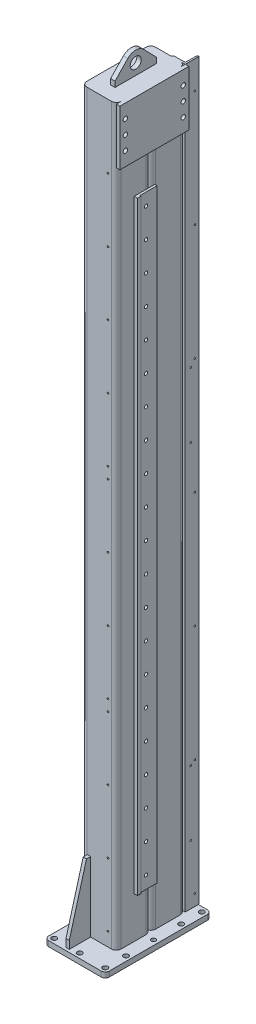
from build123d import *

# Parameters (mm, degrees)
EXTRUDE_1_DEPTH           = 2643
EXTRUDE_2_DEPTH           = 2643
CUT_EXTRUDE_1_DEPTH       = 2648.712267222
CUT_EXTRUDE_1_DEPTH_BACK  = 2648.712267222
EXTRUDE_3_DEPTH           = 19
EXTRUDE_4_DEPTH           = 12
EXTRUDE_5_DEPTH           = 2662
EXTRUDE_6_DEPTH           = 2190
EXTRUDE_7_DEPTH           = 19
SKETCH_14_W               = 249.98
SKETCH_14_H               = 200
EXTRUDE_8_DEPTH           = 13
EXTRUDE_9_DEPTH           = 8
EXTRUDE_9_DEPTH_BACK      = 8
SKETCH_17_R               = 9
CUT_EXTRUDE_3_DEPTH       = 19
SKETCH_19_R               = 8
CUT_EXTRUDE_5_DEPTH       = 19
SKETCH_69_R               = 8
CUT_EXTRUDE_54_DEPTH      = 75.5
SKETCH_71_R               = 8
CUT_EXTRUDE_56_DEPTH      = 75.5
SKETCH_73_R               = 6
CUT_EXTRUDE_58_DEPTH      = 70.5
SKETCH_75_R               = 3
CUT_EXTRUDE_60_DEPTH      = 105
SKETCH_77_R               = 3
CUT_EXTRUDE_62_DEPTH      = 62.5
SKETCH_79_R               = 3
CUT_EXTRUDE_64_DEPTH      = 62.5
CUT_EXTRUDE_65_DEPTH      = 2771.06245417
CUT_EXTRUDE_65_DEPTH_BACK = 2771.06245417
SKETCH_80_R               = 20


with BuildPart() as part:
    # ｽｹｯﾁ2 → ﾎﾞｽ - 押し出し1 (new body)
    with BuildSketch(Plane(origin=(0, 19, 0), x_dir=(1, 0, 0), z_dir=(0, 1, 0))):
        with BuildLine():
            Line((-44.5, -105), (44.5, -105))
            ThreePointArc((44.5, -105), (57.227922061, -99.727922061), (62.5, -87))
            Line((62.5, -87), (62.5, 2))
            ThreePointArc((62.5, 2), (57.227922061, 14.727922061), (44.5, 20))
            Line((44.5, 20), (-44.5, 20))
            ThreePointArc((-44.5, 20), (-57.227922061, 14.727922061), (-62.5, 2))
            Line((-62.5, 2), (-62.5, -87))
            ThreePointArc((-62.5, -87), (-57.227922061, -99.727922061), (-44.5, -105))
        make_face()
    extrude(amount=EXTRUDE_1_DEPTH)

    # ｽｹｯﾁ3 → ﾎﾞｽ - 押し出し2 (add)
    with BuildSketch(Plane(origin=(0, 19, 0), x_dir=(1, 0, 0), z_dir=(0, 1, 0))):
        with BuildLine():
            Line((-44.5, 20), (44.5, 20))
            ThreePointArc((44.5, 20), (57.227922061, 25.272077939), (62.5, 38))
            Line((62.5, 38), (62.5, 127))
            ThreePointArc((62.5, 127), (57.227922061, 139.727922061), (44.5, 145))
            Line((44.5, 145), (-44.5, 145))
            ThreePointArc((-44.5, 145), (-57.227922061, 139.727922061), (-62.5, 127))
            Line((-62.5, 127), (-62.5, 38))
            ThreePointArc((-62.5, 38), (-57.227922061, 25.272077939), (-44.5, 20))
        make_face()
    extrude(amount=EXTRUDE_2_DEPTH)

    # ｽｹｯﾁ4 → ｶｯﾄ - 押し出し1 (cut, two sides: drawn at the far end of the back side and taken through both)
    with BuildSketch(Plane(origin=(0, 19, 0), x_dir=(1, 0, 0), z_dir=(0, 1, 0)).offset(-CUT_EXTRUDE_1_DEPTH_BACK)):
        with BuildLine():
            Line((-44.5, -96), (44.5, -96))
            ThreePointArc((44.5, -96), (50.863961031, -93.363961031), (53.5, -87))
            Line((53.5, -87), (53.5, 2))
            ThreePointArc((53.5, 2), (50.863961031, 8.363961031), (44.5, 11))
            Line((44.5, 11), (-44.5, 11))
            ThreePointArc((-44.5, 11), (-50.863961031, 8.363961031), (-53.5, 2))
            Line((-53.5, 2), (-53.5, -87))
            ThreePointArc((-53.5, -87), (-50.863961031, -93.363961031), (-44.5, -96))
        make_face()
        with BuildLine():
            Line((-44.5, 29), (44.5, 29))
            ThreePointArc((44.5, 29), (50.863961031, 31.636038969), (53.5, 38))
            Line((53.5, 38), (53.5, 127))
            ThreePointArc((53.5, 127), (50.863961031, 133.363961031), (44.5, 136))
            Line((44.5, 136), (-44.5, 136))
            ThreePointArc((-44.5, 136), (-50.863961031, 133.363961031), (-53.5, 127))
            Line((-53.5, 127), (-53.5, 38))
            ThreePointArc((-53.5, 38), (-50.863961031, 31.636038969), (-44.5, 29))
        make_face()
    extrude(amount=CUT_EXTRUDE_1_DEPTH + CUT_EXTRUDE_1_DEPTH_BACK, mode=Mode.SUBTRACT)

    # ｽｹｯﾁ5 → ﾎﾞｽ - 押し出し3 (add)
    with BuildSketch(Plane(origin=(0, 0, 0), x_dir=(1, 0, 0), z_dir=(0, 1, 0))):
        with BuildLine():
            Line((-95, -192.5), (95, -192.5))
            ThreePointArc((95, -192.5), (105.606601718, -188.106601718), (110, -177.5))
            Line((110, -177.5), (110, 177.5))
            ThreePointArc((110, 177.5), (105.606601718, 188.106601718), (95, 192.5))
            Line((95, 192.5), (-95, 192.5))
            ThreePointArc((-95, 192.5), (-105.606601718, 188.106601718), (-110, 177.5))
            Line((-110, 177.5), (-110, -177.5))
            ThreePointArc((-110, -177.5), (-105.606601718, -188.106601718), (-95, -192.5))
        make_face()
    extrude(amount=EXTRUDE_3_DEPTH)

    # ｽｹｯﾁ7 → ﾎﾞｽ - 押し出し4 (add)
    with BuildSketch(Plane(origin=(-42.5, 0, 0), x_dir=(0, 0, -1), z_dir=(1, 0, 0))):
        Polygon((-105, 19), (-105, 272), (-120, 272), (-182.5, 47), (-182.5, 19), align=None)
    extrude(amount=EXTRUDE_4_DEPTH)

    # ｽｹｯﾁ8 → ﾎﾞｽ - 押し出し5 (add)
    with BuildSketch(Plane(origin=(0, 19, 0), x_dir=(1, 0, 0), z_dir=(0, 1, 0))):
        with BuildLine():
            Line((62.5, 145), (12.5, 145))
            Line((12.5, 145), (12.5, 147))
            ThreePointArc((12.5, 147), (13.671572875, 149.828427125), (16.5, 151))
            Line((16.5, 151), (50.5, 151))
            ThreePointArc((50.5, 151), (54.742640687, 152.757359313), (56.5, 157))
            Line((56.5, 157), (56.5, 191))
            ThreePointArc((56.5, 191), (57.671572875, 193.828427125), (60.5, 195))
            Line((60.5, 195), (62.5, 195))
            Line((62.5, 195), (62.5, 145))
        make_face()
    extrude(amount=EXTRUDE_5_DEPTH)

    # ｽｹｯﾁ10 → ﾎﾞｽ - 押し出し6 (add)
    with BuildSketch(Plane(origin=(0, 169, 0), x_dir=(1, 0, 0), z_dir=(0, 1, 0))):
        Polygon((62.5, -40), (74.5, -40), (74.5, -27.5), (70.5, -27.5), (70.5, 35), (62.5, 35), align=None)
    extrude(amount=EXTRUDE_6_DEPTH)

    # ｽｹｯﾁ12 → ﾎﾞｽ - 押し出し7 (add)
    with BuildSketch(Plane(origin=(0, 2662, 0), x_dir=(1, 0, 0), z_dir=(0, 1, 0))):
        with BuildLine():
            Line((-44.5, -105), (44.5, -105))
            ThreePointArc((44.5, -105), (57.227922061, -99.727922061), (62.5, -87))
            Line((62.5, -87), (62.5, 127))
            ThreePointArc((62.5, 127), (57.227922061, 139.727922061), (44.5, 145))
            Line((44.5, 145), (-44.5, 145))
            ThreePointArc((-44.5, 145), (-57.227922061, 139.727922061), (-62.5, 127))
            Line((-62.5, 127), (-62.5, -87))
            ThreePointArc((-62.5, -87), (-57.227922061, -99.727922061), (-44.5, -105))
        make_face()
    extrude(amount=EXTRUDE_7_DEPTH)

    # ｽｹｯﾁ14 → ﾎﾞｽ - 押し出し8 (add)
    with BuildSketch(Plane(origin=(62.5, 0, 0), x_dir=(0, 0, -1), z_dir=(1, 0, 0))):
        with Locations((19.99, 2581)):
            Rectangle(SKETCH_14_W, SKETCH_14_H)
    extrude(amount=EXTRUDE_8_DEPTH)

    # ｽｹｯﾁ15 → ﾎﾞｽ - 押し出し9 (add, two sides: drawn at the far end of the back side and taken through both)
    with BuildSketch(Plane(origin=(0, 0, 0), x_dir=(0, 0, -1), z_dir=(1, 0, 0)).offset(-EXTRUDE_9_DEPTH_BACK)):
        with BuildLine():
            Line((-55, 2681), (95, 2681))
            Line((95, 2681), (95, 2701))
            Line((95, 2701), (48.749632993, 2748.811123724))
            ThreePointArc((48.749632993, 2748.811123724), (20, 2761), (-8.749632993, 2748.811123724))
            Line((-8.749632993, 2748.811123724), (-55, 2701))
            Line((-55, 2701), (-55, 2681))
        make_face()
    extrude(amount=EXTRUDE_9_DEPTH + EXTRUDE_9_DEPTH_BACK)

    # ｽｹｯﾁ17 → ｶｯﾄ - 押し出し3 (cut)
    with BuildSketch(Plane(origin=(0, 0, 0), x_dir=(1, 0, 0), z_dir=(0, 1, 0))):
        with Locations(Location((-92.5, -175, 0), (0, 0, 270))):
            Circle(SKETCH_17_R)
        with Locations(Location((0, -175, 0), (0, 0, 270))):
            Circle(SKETCH_17_R)
        with Locations(Location((92.5, -175, 0), (0, 0, 270))):
            Circle(SKETCH_17_R)
        with Locations(Location((-92.5, -100, 0), (0, 0, 270))):
            Circle(SKETCH_17_R)
        with Locations(Location((92.5, -100, 0), (0, 0, 270))):
            Circle(SKETCH_17_R)
        with Locations(Location((-92.5, 100, 0), (0, 0, 270))):
            Circle(SKETCH_17_R)
        with Locations(Location((92.5, 100, 0), (0, 0, 270))):
            Circle(SKETCH_17_R)
        with Locations(Location((-92.5, 175, 0), (0, 0, 270))):
            Circle(SKETCH_17_R)
        with Locations(Location((0, 175, 0), (0, 0, 270))):
            Circle(SKETCH_17_R)
        with Locations(Location((92.5, 175, 0), (0, 0, 270))):
            Circle(SKETCH_17_R)
    extrude(amount=CUT_EXTRUDE_3_DEPTH, mode=Mode.SUBTRACT)

    # ｽｹｯﾁ19 → ｶｯﾄ - 押し出し5 (cut)
    with BuildSketch(Plane(origin=(0, 0, 0), x_dir=(1, 0, 0), z_dir=(0, 1, 0))):
        with Locations(Location((-92.5, 0, 0), (0, 0, 270))):
            Circle(SKETCH_19_R)
        with Locations(Location((92.5, 0, 0), (0, 0, 270))):
            Circle(SKETCH_19_R)
    extrude(amount=CUT_EXTRUDE_5_DEPTH, mode=Mode.SUBTRACT)

    # ｽｹｯﾁ69 → ｶｯﾄ - 押し出し54 (cut)
    with BuildSketch(Plane(origin=(0, 0, 0), x_dir=(0, 0, -1), z_dir=(1, 0, 0))):
        with Locations(Location((-85, 2531, 0), (0, 0, 255.522487814))):
            Circle(SKETCH_69_R)
        with Locations(Location((125, 2531, 0), (0, 0, 75.522487814))):
            Circle(SKETCH_69_R)
        with Locations(Location((-85, 2631, 0), (0, 0, 255.522487814))):
            Circle(SKETCH_69_R)
        with Locations(Location((125, 2631, 0), (0, 0, 75.522487814))):
            Circle(SKETCH_69_R)
    extrude(amount=CUT_EXTRUDE_54_DEPTH, mode=Mode.SUBTRACT)

    # ｽｹｯﾁ71 → ｶｯﾄ - 押し出し56 (cut)
    with BuildSketch(Plane(origin=(0, 0, 0), x_dir=(0, 0, -1), z_dir=(1, 0, 0))):
        with Locations(Location((-85, 2581, 0), (0, 0, 104.477512186))):
            Circle(SKETCH_71_R)
        with Locations(Location((125, 2581, 0), (0, 0, 284.477512186))):
            Circle(SKETCH_71_R)
    extrude(amount=CUT_EXTRUDE_56_DEPTH, mode=Mode.SUBTRACT)

    # ｽｹｯﾁ73 → ｶｯﾄ - 押し出し58 (cut)
    with BuildSketch(Plane(origin=(0, 0, 0), x_dir=(0, 0, -1), z_dir=(1, 0, 0))):
        with Locations(Location((-5, 214.5, 0), (0, 0, 180))):
            Circle(SKETCH_73_R)
        with Locations(Location((-5, 319.5, 0), (0, 0, 180))):
            Circle(SKETCH_73_R)
        with Locations(Location((-5, 424.5, 0), (0, 0, 180))):
            Circle(SKETCH_73_R)
        with Locations(Location((-5, 529.5, 0), (0, 0, 180))):
            Circle(SKETCH_73_R)
        with Locations(Location((-5, 634.5, 0), (0, 0, 180))):
            Circle(SKETCH_73_R)
        with Locations(Location((-5, 739.5, 0), (0, 0, 180))):
            Circle(SKETCH_73_R)
        with Locations(Location((-5, 844.5, 0), (0, 0, 180))):
            Circle(SKETCH_73_R)
        with Locations(Location((-5, 949.5, 0), (0, 0, 180))):
            Circle(SKETCH_73_R)
        with Locations(Location((-5, 1054.5, 0), (0, 0, 180))):
            Circle(SKETCH_73_R)
        with Locations(Location((-5, 1159.5, 0), (0, 0, 180))):
            Circle(SKETCH_73_R)
        with Locations(Location((-5, 1264.5, 0), (0, 0, 180))):
            Circle(SKETCH_73_R)
        with Locations(Location((-5, 1369.5, 0), (0, 0, 180))):
            Circle(SKETCH_73_R)
        with Locations(Location((-5, 1474.5, 0), (0, 0, 180))):
            Circle(SKETCH_73_R)
        with Locations(Location((-5, 1579.5, 0), (0, 0, 180))):
            Circle(SKETCH_73_R)
        with Locations(Location((-5, 1684.5, 0), (0, 0, 180))):
            Circle(SKETCH_73_R)
        with Locations(Location((-5, 1789.5, 0), (0, 0, 180))):
            Circle(SKETCH_73_R)
        with Locations(Location((-5, 1894.5, 0), (0, 0, 180))):
            Circle(SKETCH_73_R)
        with Locations(Location((-5, 1999.5, 0), (0, 0, 180))):
            Circle(SKETCH_73_R)
        with Locations(Location((-5, 2104.5, 0), (0, 0, 180))):
            Circle(SKETCH_73_R)
        with Locations(Location((-5, 2209.5, 0), (0, 0, 180))):
            Circle(SKETCH_73_R)
        with Locations(Location((-5, 2314.5, 0), (0, 0, 180))):
            Circle(SKETCH_73_R)
    extrude(amount=CUT_EXTRUDE_58_DEPTH, mode=Mode.SUBTRACT)

    # ｽｹｯﾁ75 → ｶｯﾄ - 押し出し60 (cut)
    with BuildSketch(Plane.XY):
        with Locations(Location((32.5, 2448.5, 0), (0, 0, 180))):
            Circle(SKETCH_75_R)
        with Locations(Location((32.5, 2218.5, 0), (0, 0, 180))):
            Circle(SKETCH_75_R)
        with Locations(Location((32.5, 1988.5, 0), (0, 0, 180))):
            Circle(SKETCH_75_R)
        with Locations(Location((32.5, 1758.5, 0), (0, 0, 180))):
            Circle(SKETCH_75_R)
        with Locations(Location((32.5, 1528.5, 0), (0, 0, 180))):
            Circle(SKETCH_75_R)
        with Locations(Location((32.5, 1488.5, 0), (0, 0, 180))):
            Circle(SKETCH_75_R)
        with Locations(Location((32.5, 1258.5, 0), (0, 0, 180))):
            Circle(SKETCH_75_R)
        with Locations(Location((32.5, 1028.5, 0), (0, 0, 180))):
            Circle(SKETCH_75_R)
        with Locations(Location((32.5, 798.5, 0), (0, 0, 180))):
            Circle(SKETCH_75_R)
        with Locations(Location((32.5, 758.5, 0), (0, 0, 180))):
            Circle(SKETCH_75_R)
        with Locations(Location((32.5, 528.5, 0), (0, 0, 180))):
            Circle(SKETCH_75_R)
        with Locations(Location((32.5, 298.5, 0), (0, 0, 180))):
            Circle(SKETCH_75_R)
        with Locations(Location((32.5, 68.5, 0), (0, 0, 180))):
            Circle(SKETCH_75_R)
    extrude(amount=CUT_EXTRUDE_60_DEPTH, mode=Mode.SUBTRACT)

    # ｽｹｯﾁ77 → ｶｯﾄ - 押し出し62 (cut)
    with BuildSketch(Plane(origin=(0, 0, 0), x_dir=(0, 0, -1), z_dir=(1, 0, 0))):
        with Locations((180, 60)):
            Circle(SKETCH_77_R)
        with Locations((180, 480)):
            Circle(SKETCH_77_R)
        with Locations((180, 900)):
            Circle(SKETCH_77_R)
        with Locations((180, 1320)):
            Circle(SKETCH_77_R)
        with Locations((180, 1740)):
            Circle(SKETCH_77_R)
        with Locations((180, 2160)):
            Circle(SKETCH_77_R)
        with Locations((180, 2580)):
            Circle(SKETCH_77_R)
    extrude(amount=CUT_EXTRUDE_62_DEPTH, mode=Mode.SUBTRACT)

    # ｽｹｯﾁ79 → ｶｯﾄ - 押し出し64 (cut)
    with BuildSketch(Plane(origin=(0, 0, 0), x_dir=(0, 0, -1), z_dir=(1, 0, 0))):
        with Locations((165, 1718.5)):
            Circle(SKETCH_79_R)
        with Locations((165, 1483.5)):
            Circle(SKETCH_79_R)
        with Locations((165, 468.5)):
            Circle(SKETCH_79_R)
        with Locations((165, 233.5)):
            Circle(SKETCH_79_R)
    extrude(amount=CUT_EXTRUDE_64_DEPTH, mode=Mode.SUBTRACT)

    # ｽｹｯﾁ80 → ｶｯﾄ - 押し出し65 (cut, two sides: drawn at the far end of the back side and taken through both)
    with BuildSketch(Plane(origin=(0, 0, 0), x_dir=(0, 0, -1), z_dir=(1, 0, 0)).offset(-CUT_EXTRUDE_65_DEPTH_BACK)):
        with Locations((20, 2721)):
            Circle(SKETCH_80_R)
    extrude(amount=CUT_EXTRUDE_65_DEPTH + CUT_EXTRUDE_65_DEPTH_BACK, mode=Mode.SUBTRACT)


solid = part.part
